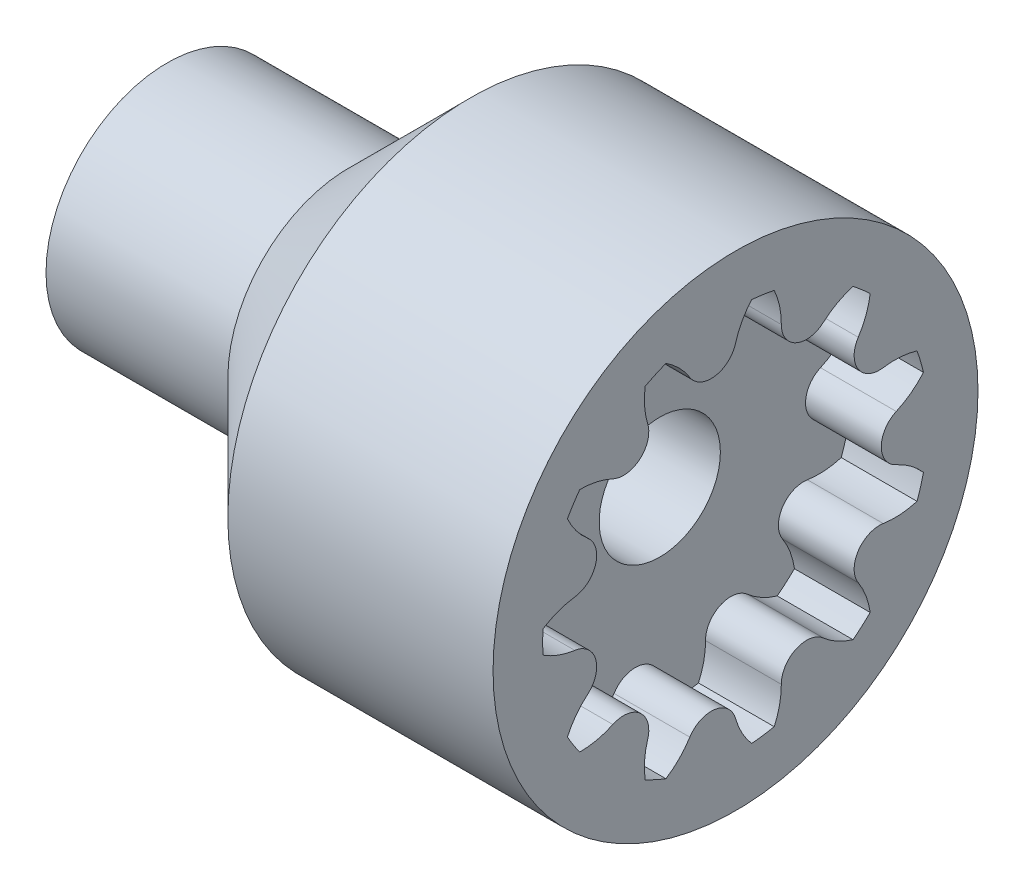
from build123d import *

# Parameters (mm, degrees)
SKETCH1_R           = 16
SKETCH1_R_2         = 4
BOSS_EXTRUDE1_DEPTH = 12.5
BOSS_EXTRUDE2_START = 5
SKETCH1_3_R         = 16
BOSS_EXTRUDE2_DEPTH = 5
SKETCH2_R           = 16
BOSS_EXTRUDE3_DEPTH = 8
BOSS_EXTRUDE3_TAPER = 45
SKETCH4_R           = 8
BOSS_EXTRUDE4_DEPTH = 12


with BuildPart() as part:
    # Sketch1 → Boss-Extrude1 (new body)
    with BuildSketch(Plane.YZ):
        Circle(SKETCH1_R)
        Circle(SKETCH1_R_2, mode=Mode.SUBTRACT)
    extrude(amount=-BOSS_EXTRUDE1_DEPTH)

    # Sketch1<3> → Boss-Extrude2 (add)
    with BuildSketch(Plane.YZ.offset(BOSS_EXTRUDE2_START)):
        Circle(SKETCH1_3_R)
        with BuildLine():
            ThreePointArc((-4.453103796, -9.74483847), (-4.442785625, -9.66347175), (-4.436480838, -9.581696098))
            ThreePointArc((-4.436480838, -9.581696098), (-5.200182393, -8.091641748), (-6.872836595, -8.015945326))
            ThreePointArc((-6.872836595, -8.015945326), (-6.944603241, -8.055651196), (-7.014330689, -8.098837891))
            ThreePointArc((-7.014330689, -8.098837891), (-8.017688064, -8.608122706), (-9.107689918, -8.887394979))
            ThreePointArc((-9.107689918, -8.887394979), (-9.617215633, -8.333364784), (-10.093093531, -7.750178588))
            ThreePointArc((-10.093093531, -7.750178588), (-9.661540409, -6.711015969), (-9.014646736, -5.790350112))
            ThreePointArc((-9.014646736, -5.790350112), (-8.961976369, -5.727478496), (-8.912461189, -5.662093066))
            ThreePointArc((-8.912461189, -5.662093066), (-8.749343619, -3.995691347), (-10.1155453, -3.027706329))
            ThreePointArc((-10.1155453, -3.027706329), (-10.197385858, -3.022309054), (-10.27939281, -3.02094251))
            ThreePointArc((-10.27939281, -3.02094251), (-11.398810905, -2.906924208), (-12.466764806, -2.552563501))
            ThreePointArc((-12.466764806, -2.552563501), (-12.595873777, -1.811013243), (-12.680913477, -1.06312678))
            ThreePointArc((-12.680913477, -1.06312678), (-11.756054161, -0.422242789), (-10.714103032, 0.002533493))
            ThreePointArc((-10.714103032, 0.002533493), (-10.635802938, 0.026948711), (-10.558798085, 0.055184508))
            ThreePointArc((-10.558798085, 0.055184508), (-9.520650065, 1.368862824), (-10.146639845, 2.921808034))
            ThreePointArc((-10.146639845, 2.921808034), (-10.212570517, 2.970594857), (-10.280820345, 3.016080773))
            ThreePointArc((-10.280820345, 3.016080773), (-11.160891825, 3.717202186), (-11.867729954, 4.592688853))
            ThreePointArc((-11.867729954, 4.592688853), (-11.575430994, 5.286322206), (-11.242632993, 5.961460269))
            ThreePointArc((-11.242632993, 5.961460269), (-10.118103781, 6.000589494), (-9.011907317, 5.794612731))
            ThreePointArc((-9.011907317, 5.794612731), (-8.932837223, 5.772819893), (-8.852791194, 5.75494139))
            ThreePointArc((-8.852791194, 5.75494139), (-7.269217386, 6.298812721), (-6.956247932, 7.943668991))
            ThreePointArc((-6.956247932, 7.943668991), (-6.985336195, 8.020355891), (-7.018160061, 8.095519721))
            ThreePointArc((-7.018160061, 8.095519721), (-7.379468448, 9.161143151), (-7.500774695, 10.279794946))
            ThreePointArc((-7.500774695, 10.279794946), (-6.879870658, 10.705287707), (-6.234895971, 11.093325804))
            ThreePointArc((-6.234895971, 11.093325804), (-5.267726942, 10.518277011), (-4.448494704, 9.74694337))
            ThreePointArc((-4.448494704, 9.74694337), (-4.393758806, 9.685861548), (-4.33608565, 9.627545044))
            ThreePointArc((-4.33608565, 9.627545044), (-2.709859549, 9.228934084), (-1.557296451, 10.443471171))
            ThreePointArc((-1.557296451, 10.443471171), (-1.540306987, 10.523710598), (-1.527283546, 10.604688358))
            ThreePointArc((-1.527283546, 10.604688358), (-1.255115981, 11.696485895), (-0.752376468, 12.703138778))
            ThreePointArc((-0.752376468, 12.703138778), (-0.376352864, 12.719833477), (0, 12.7254))
            ThreePointArc((0, 12.7254), (0.376352864, 12.719833477), (0.752376468, 12.703138778))
            ThreePointArc((0.752376468, 12.703138778), (1.255115981, 11.696485895), (1.527283546, 10.604688358))
            ThreePointArc((1.527283546, 10.604688358), (1.540306987, 10.523710598), (1.557296451, 10.443471171))
            ThreePointArc((1.557296451, 10.443471171), (2.709859549, 9.228934084), (4.33608565, 9.627545044))
            ThreePointArc((4.33608565, 9.627545044), (4.393758806, 9.685861548), (4.448494704, 9.74694337))
            ThreePointArc((4.448494704, 9.74694337), (5.267726942, 10.518277011), (6.234895971, 11.093325804))
            ThreePointArc((6.234895971, 11.093325804), (6.879870658, 10.705287707), (7.500774695, 10.279794946))
            ThreePointArc((7.500774695, 10.279794946), (7.379468448, 9.161143151), (7.018160061, 8.095519721))
            ThreePointArc((7.018160061, 8.095519721), (6.985336195, 8.020355891), (6.956247932, 7.943668991))
            ThreePointArc((6.956247932, 7.943668991), (7.269217386, 6.298812721), (8.852791194, 5.75494139))
            ThreePointArc((8.852791194, 5.75494139), (8.932837223, 5.772819893), (9.011907317, 5.794612731))
            ThreePointArc((9.011907317, 5.794612731), (10.118103781, 6.000589494), (11.242632993, 5.961460269))
            ThreePointArc((11.242632993, 5.961460269), (11.575430994, 5.286322206), (11.867729954, 4.592688853))
            ThreePointArc((11.867729954, 4.592688853), (11.160891825, 3.717202186), (10.280820345, 3.016080773))
            ThreePointArc((10.280820345, 3.016080773), (10.212570517, 2.970594857), (10.146639845, 2.921808034))
            ThreePointArc((10.146639845, 2.921808034), (9.520650065, 1.368862824), (10.558798085, 0.055184508))
            ThreePointArc((10.558798085, 0.055184508), (10.635802938, 0.026948711), (10.714103032, 0.002533493))
            ThreePointArc((10.714103032, 0.002533493), (11.756054161, -0.422242789), (12.680913477, -1.06312678))
            ThreePointArc((12.680913477, -1.06312678), (12.595873777, -1.811013243), (12.466764806, -2.552563501))
            ThreePointArc((12.466764806, -2.552563501), (11.398810905, -2.906924208), (10.27939281, -3.02094251))
            ThreePointArc((10.27939281, -3.02094251), (10.197385858, -3.022309054), (10.1155453, -3.027706329))
            ThreePointArc((10.1155453, -3.027706329), (8.749343619, -3.995691347), (8.912461189, -5.662093066))
            ThreePointArc((8.912461189, -5.662093066), (8.961976369, -5.727478496), (9.014646736, -5.790350112))
            ThreePointArc((9.014646736, -5.790350112), (9.661540409, -6.711015969), (10.093093531, -7.750178588))
            ThreePointArc((10.093093531, -7.750178588), (9.617215633, -8.333364784), (9.107689918, -8.887394979))
            ThreePointArc((9.107689918, -8.887394979), (8.01768807, -8.608122703), (7.014330701, -8.098837886))
            ThreePointArc((7.014330701, -8.098837886), (6.944603253, -8.055651191), (6.872836606, -8.015945321))
            ThreePointArc((6.872836606, -8.015945321), (5.200182396, -8.091641744), (4.436480837, -9.5816961))
            ThreePointArc((4.436480837, -9.5816961), (4.442785625, -9.663471753), (4.453103796, -9.744838473))
            ThreePointArc((4.453103796, -9.744838473), (4.499555842, -10.869089), (4.300787703, -11.976603454))
            ThreePointArc((4.300787703, -11.976603454), (3.585159479, -12.209931886), (2.856987833, -12.400541346))
            ThreePointArc((2.856987833, -12.400541346), (2.091005912, -11.576303066), (1.522268135, -10.605409465))
            ThreePointArc((1.522268135, -10.605409465), (1.486958164, -10.531381002), (1.448050834, -10.459178321))
            ThreePointArc((1.448050834, -10.459178321), (1e-09, -9.618553067), (-1.448050833, -10.459178319))
            ThreePointArc((-1.448050833, -10.459178319), (-1.486958163, -10.531381001), (-1.522268135, -10.605409465))
            ThreePointArc((-1.522268135, -10.605409465), (-2.091005912, -11.576303066), (-2.856987833, -12.400541346))
            ThreePointArc((-2.856987833, -12.400541346), (-3.585159479, -12.209931886), (-4.300787703, -11.976603454))
            ThreePointArc((-4.300787703, -11.976603454), (-4.499555842, -10.869088998), (-4.453103796, -9.74483847))
        make_face(mode=Mode.SUBTRACT)
    extrude(amount=-BOSS_EXTRUDE2_DEPTH)

    # Sketch2 → Boss-Extrude3 (add)
    with BuildSketch(Plane(origin=(-12.5, 0, 0), x_dir=(0, -1, 0), z_dir=(-1, 0, 0))):
        Circle(SKETCH2_R)
    extrude(amount=BOSS_EXTRUDE3_DEPTH, taper=BOSS_EXTRUDE3_TAPER)

    # Sketch4 → Boss-Extrude4 (add)
    with BuildSketch(Plane(origin=(-20.5, 0, 0), x_dir=(0, -1, 0), z_dir=(-1, 0, 0))):
        Circle(SKETCH4_R)
        with BuildLine():
            Line((-1.19, 3.818887272), (-1.19, 5.19))
            Line((-1.19, 5.19), (1.19, 5.19))
            Line((1.19, 5.19), (1.19, 3.818887272))
            ThreePointArc((1.19, 3.818887272), (3.221800739, 2.370653918), (4, 0))
            ThreePointArc((4, 0), (-2.370653918, -3.221800739), (-1.19, 3.818887272))
        make_face(mode=Mode.SUBTRACT)
    extrude(amount=BOSS_EXTRUDE4_DEPTH)


solid = part.part
